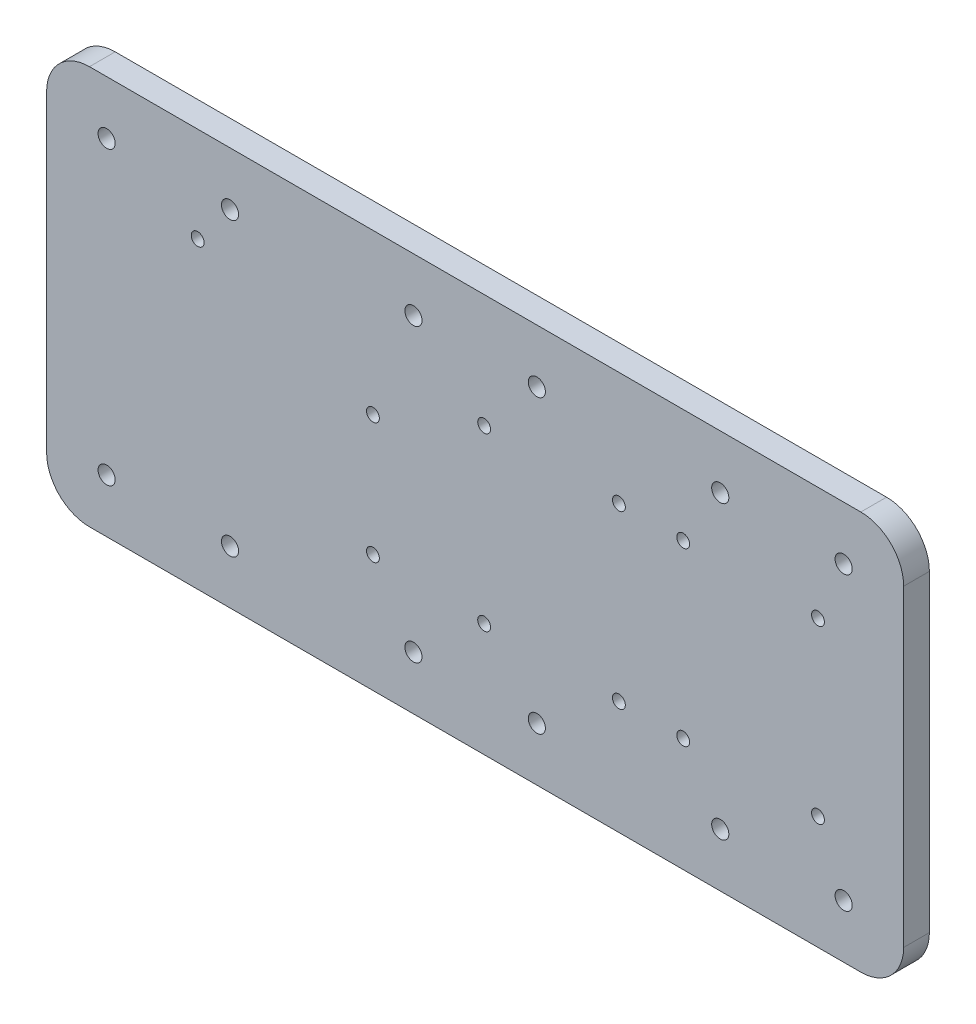
from build123d import *

# Parameters (mm, degrees)
EXTRUDE_1_DEPTH     = 6
SKETCH_10_R         = 1.5
CUT_EXTRUDE_1_DEPTH = 6
CUT_EXTRUDE_2_REACH = 216.215
SKETCH_11_R         = 2
FILLET_1_R          = 10


with BuildPart() as part:
    # 草圖1 → 填料-伸長1 (new body)
    with BuildSketch(Plane.XY):
        Polygon((-200, 60), (-200, 76.5), (-168.2, 76.5), (-125.9, 76.5), (-94.1, 76.5), (-51.8, 76.5), (0, 76.5), (0, 60), (0, 0), (0, -16.5), (-51.8, -16.5), (-94.1, -16.5), (-125.9, -16.5), (-168.2, -16.5), (-200, -16.5), (-200, 0), align=None)
    extrude(amount=EXTRUDE_1_DEPTH)

    # 草圖10 → 除料-伸長1 (cut)
    with BuildSketch(Plane.XY.offset(6)):
        with Locations((-164.75, 54.3)):
            Circle(SKETCH_10_R)
        with Locations((-123.85, 39.25)):
            Circle(SKETCH_10_R)
        with Locations((-123.85, 10.975)):
            Circle(SKETCH_10_R)
        with Locations((-97.9, 50)):
            Circle(SKETCH_10_R)
        with Locations((-66.45, 50)):
            Circle(SKETCH_10_R)
        with Locations((-51.45, 50)):
            Circle(SKETCH_10_R)
        with Locations((-20, 50)):
            Circle(SKETCH_10_R)
        with Locations((-20, 10)):
            Circle(SKETCH_10_R)
        with Locations((-51.45, 10)):
            Circle(SKETCH_10_R)
        with Locations((-66.45, 10)):
            Circle(SKETCH_10_R)
        with Locations((-97.9, 10)):
            Circle(SKETCH_10_R)
    extrude(amount=-CUT_EXTRUDE_1_DEPTH, mode=Mode.SUBTRACT)

    # 草圖11 → 除料-伸長2 (cut, up to next)
    with BuildSketch(Plane.XY.offset(6), mode=Mode.PRIVATE) as cut_extrude_2_sk1:
        with Locations((-14, 64)):
            Circle(SKETCH_11_R)
    cut_extrude_2_tool1 = extrude(cut_extrude_2_sk1.sketch, amount=-CUT_EXTRUDE_2_REACH, mode=Mode.PRIVATE) & part.part
    # 草圖11 → 除料-伸長2 (cut, up to next)
    with BuildSketch(Plane.XY.offset(6), mode=Mode.PRIVATE) as cut_extrude_2_sk2:
        with Locations((-42.8, 64)):
            Circle(SKETCH_11_R)
    cut_extrude_2_tool2 = extrude(cut_extrude_2_sk2.sketch, amount=-CUT_EXTRUDE_2_REACH, mode=Mode.PRIVATE) & part.part
    # 草圖11 → 除料-伸長2 (cut, up to next)
    with BuildSketch(Plane.XY.offset(6), mode=Mode.PRIVATE) as cut_extrude_2_sk3:
        with Locations((-85.6, 64)):
            Circle(SKETCH_11_R)
    cut_extrude_2_tool3 = extrude(cut_extrude_2_sk3.sketch, amount=-CUT_EXTRUDE_2_REACH, mode=Mode.PRIVATE) & part.part
    # 草圖11 → 除料-伸長2 (cut, up to next)
    with BuildSketch(Plane.XY.offset(6), mode=Mode.PRIVATE) as cut_extrude_2_sk4:
        with Locations((-114.4, 64)):
            Circle(SKETCH_11_R)
    cut_extrude_2_tool4 = extrude(cut_extrude_2_sk4.sketch, amount=-CUT_EXTRUDE_2_REACH, mode=Mode.PRIVATE) & part.part
    # 草圖11 → 除料-伸長2 (cut, up to next)
    with BuildSketch(Plane.XY.offset(6), mode=Mode.PRIVATE) as cut_extrude_2_sk5:
        with Locations((-157.2, 64)):
            Circle(SKETCH_11_R)
    cut_extrude_2_tool5 = extrude(cut_extrude_2_sk5.sketch, amount=-CUT_EXTRUDE_2_REACH, mode=Mode.PRIVATE) & part.part
    # 草圖11 → 除料-伸長2 (cut, up to next)
    with BuildSketch(Plane.XY.offset(6), mode=Mode.PRIVATE) as cut_extrude_2_sk6:
        with Locations((-186, 64)):
            Circle(SKETCH_11_R)
    cut_extrude_2_tool6 = extrude(cut_extrude_2_sk6.sketch, amount=-CUT_EXTRUDE_2_REACH, mode=Mode.PRIVATE) & part.part
    # 草圖11 → 除料-伸長2 (cut, up to next)
    with BuildSketch(Plane.XY.offset(6), mode=Mode.PRIVATE) as cut_extrude_2_sk7:
        with Locations((-14, -4)):
            Circle(SKETCH_11_R)
    cut_extrude_2_tool7 = extrude(cut_extrude_2_sk7.sketch, amount=-CUT_EXTRUDE_2_REACH, mode=Mode.PRIVATE) & part.part
    # 草圖11 → 除料-伸長2 (cut, up to next)
    with BuildSketch(Plane.XY.offset(6), mode=Mode.PRIVATE) as cut_extrude_2_sk8:
        with Locations((-42.8, -4)):
            Circle(SKETCH_11_R)
    cut_extrude_2_tool8 = extrude(cut_extrude_2_sk8.sketch, amount=-CUT_EXTRUDE_2_REACH, mode=Mode.PRIVATE) & part.part
    # 草圖11 → 除料-伸長2 (cut, up to next)
    with BuildSketch(Plane.XY.offset(6), mode=Mode.PRIVATE) as cut_extrude_2_sk9:
        with Locations((-85.6, -4)):
            Circle(SKETCH_11_R)
    cut_extrude_2_tool9 = extrude(cut_extrude_2_sk9.sketch, amount=-CUT_EXTRUDE_2_REACH, mode=Mode.PRIVATE) & part.part
    # 草圖11 → 除料-伸長2 (cut, up to next)
    with BuildSketch(Plane.XY.offset(6), mode=Mode.PRIVATE) as cut_extrude_2_sk10:
        with Locations((-114.4, -4)):
            Circle(SKETCH_11_R)
    cut_extrude_2_tool10 = extrude(cut_extrude_2_sk10.sketch, amount=-CUT_EXTRUDE_2_REACH, mode=Mode.PRIVATE) & part.part
    # 草圖11 → 除料-伸長2 (cut, up to next)
    with BuildSketch(Plane.XY.offset(6), mode=Mode.PRIVATE) as cut_extrude_2_sk11:
        with Locations((-157.2, -4)):
            Circle(SKETCH_11_R)
    cut_extrude_2_tool11 = extrude(cut_extrude_2_sk11.sketch, amount=-CUT_EXTRUDE_2_REACH, mode=Mode.PRIVATE) & part.part
    # 草圖11 → 除料-伸長2 (cut, up to next)
    with BuildSketch(Plane.XY.offset(6), mode=Mode.PRIVATE) as cut_extrude_2_sk12:
        with Locations((-186, -4)):
            Circle(SKETCH_11_R)
    cut_extrude_2_tool12 = extrude(cut_extrude_2_sk12.sketch, amount=-CUT_EXTRUDE_2_REACH, mode=Mode.PRIVATE) & part.part
    add(cut_extrude_2_tool1.solids().sort_by_distance((-14, 64, 6))[0], mode=Mode.SUBTRACT)
    add(cut_extrude_2_tool2.solids().sort_by_distance((-42.8, 64, 6))[0], mode=Mode.SUBTRACT)
    add(cut_extrude_2_tool3.solids().sort_by_distance((-85.6, 64, 6))[0], mode=Mode.SUBTRACT)
    add(cut_extrude_2_tool4.solids().sort_by_distance((-114.4, 64, 6))[0], mode=Mode.SUBTRACT)
    add(cut_extrude_2_tool5.solids().sort_by_distance((-157.2, 64, 6))[0], mode=Mode.SUBTRACT)
    add(cut_extrude_2_tool6.solids().sort_by_distance((-186, 64, 6))[0], mode=Mode.SUBTRACT)
    add(cut_extrude_2_tool7.solids().sort_by_distance((-14, -4, 6))[0], mode=Mode.SUBTRACT)
    add(cut_extrude_2_tool8.solids().sort_by_distance((-42.8, -4, 6))[0], mode=Mode.SUBTRACT)
    add(cut_extrude_2_tool9.solids().sort_by_distance((-85.6, -4, 6))[0], mode=Mode.SUBTRACT)
    add(cut_extrude_2_tool10.solids().sort_by_distance((-114.4, -4, 6))[0], mode=Mode.SUBTRACT)
    add(cut_extrude_2_tool11.solids().sort_by_distance((-157.2, -4, 6))[0], mode=Mode.SUBTRACT)
    add(cut_extrude_2_tool12.solids().sort_by_distance((-186, -4, 6))[0], mode=Mode.SUBTRACT)

    # 圓角1
    fillet_1_edges = [part.edges().sort_by_distance(p)[0] for p in [
        (0, -16.5, 3),
        (-200, -16.5, 3),
        (-200, 76.5, 3),
        (0, 76.5, 3),
    ]]
    fillet(fillet_1_edges, radius=FILLET_1_R)


solid = part.part
